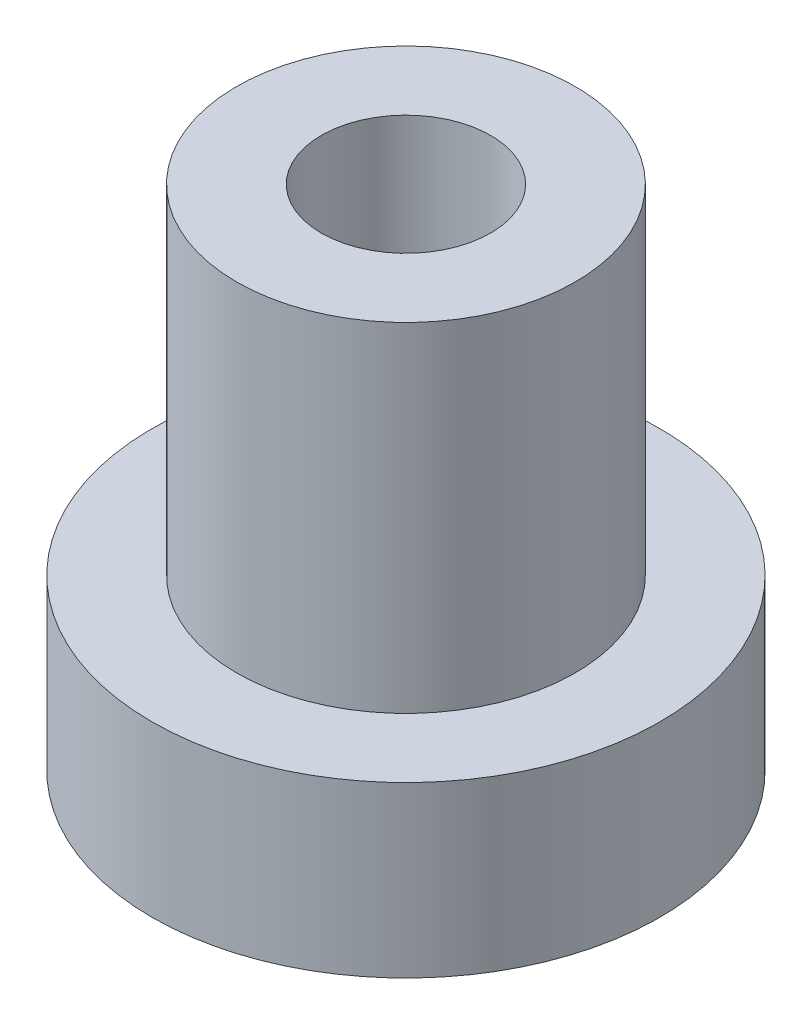
from build123d import *


with BuildPart() as part:
    # Sketch1 → Revolve1 (revolve)
    with BuildSketch(Plane.XY, mode=Mode.PRIVATE) as revolve1_sk:
        Polygon((0, 0), (-9.525, 0), (-9.525, 6.35), (-6.35, 6.35), (-6.35, 19.05), (-3.175, 19.05), (-3.175, 6.35), (0, 6.35), align=None)
    revolve(revolve1_sk.sketch.rotate(Axis((0, 0, 0), (0, -1, 0)), 270), axis=Axis((0, 0, 0), (0, -1, 0)))


solid = part.part
